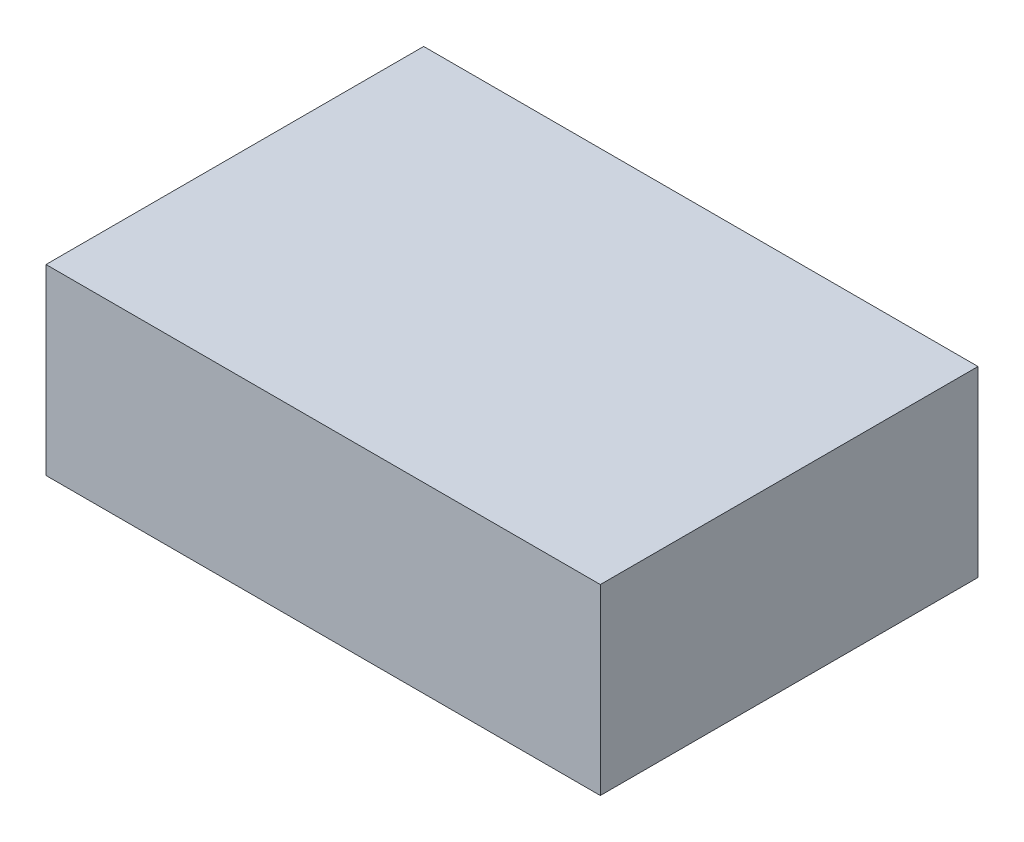
from build123d import *

# Parameters (mm, degrees)
SKETCH1_W           = 91
SKETCH1_H           = 62
BOSS_EXTRUDE1_DEPTH = 30


with BuildPart() as part:
    # Sketch1 → Boss-Extrude1 (new body)
    with BuildSketch(Plane(origin=(0, 0, 0), x_dir=(1, 0, 0), z_dir=(0, 1, 0))):
        with Locations((45.5, 31)):
            Rectangle(SKETCH1_W, SKETCH1_H)
    extrude(amount=BOSS_EXTRUDE1_DEPTH)


solid = part.part
